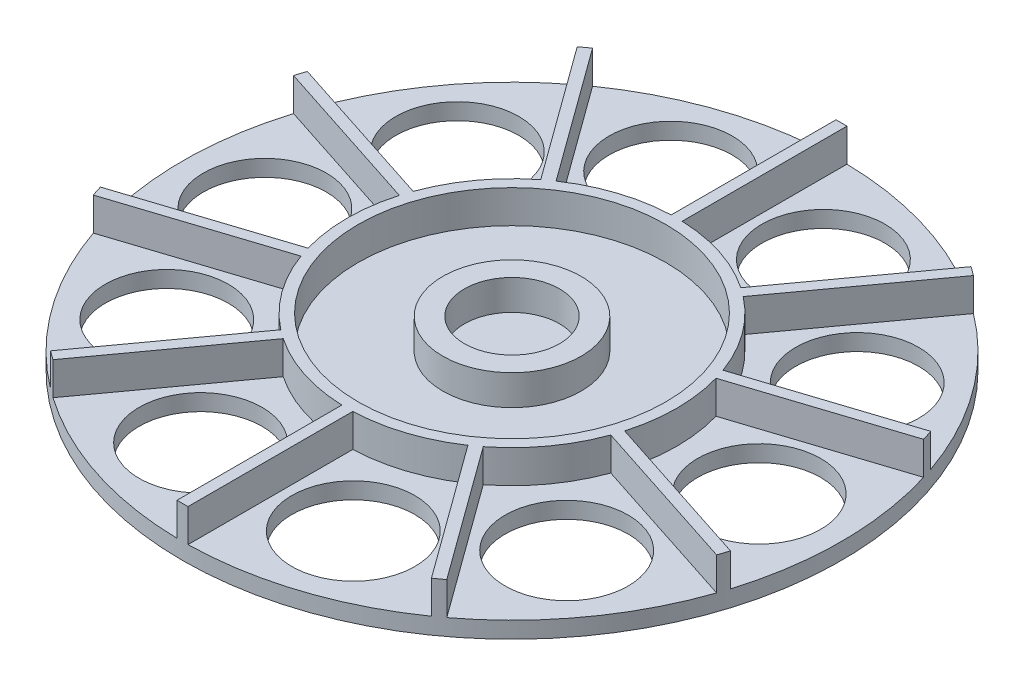
from build123d import *
from build123d.topology import SkipClean

# Parameters (mm, degrees)
SKETCH1_R           = 76.2
SKETCH1_R_2         = 14.224
BOSS_EXTRUDE1_DEPTH = 3.81
SKETCH3_R           = 38.1
SKETCH3_R_2         = 35.56
BOSS_EXTRUDE3_DEPTH = 7.62
BOSS_EXTRUDE4_DEPTH = 7.62
SKETCH4_R           = 16
SKETCH4_R_2         = 11
BOSS_EXTRUDE5_DEPTH = 7


with BuildPart() as part:
    # Sketch1 → Boss-Extrude1 (new body)
    with BuildSketch(Plane(origin=(0, 0, 0), x_dir=(1, 0, 0), z_dir=(0, 1, 0))):
        with Locations(Location((0, 0, 0), (0, 0, 90))):
            Circle(SKETCH1_R)
        with Locations(Location((-57.15, 0, 0), (0, 0, 90))):
            Circle(SKETCH1_R_2, mode=Mode.SUBTRACT)
        with Locations(Location((-46.235321229, 33.591927169, 0), (0, 0, 90))):
            Circle(SKETCH1_R_2, mode=Mode.SUBTRACT)
        with Locations(Location((-17.660321229, 54.352879906, 0), (0, 0, 90))):
            Circle(SKETCH1_R_2, mode=Mode.SUBTRACT)
        with Locations(Location((17.660321229, 54.352879906, 0), (0, 0, 90))):
            Circle(SKETCH1_R_2, mode=Mode.SUBTRACT)
        with Locations(Location((46.235321229, 33.591927169, 0), (0, 0, 90))):
            Circle(SKETCH1_R_2, mode=Mode.SUBTRACT)
        with Locations(Location((57.15, 0, 0), (0, 0, 90))):
            Circle(SKETCH1_R_2, mode=Mode.SUBTRACT)
        with Locations(Location((46.235321229, -33.591927169, 0), (0, 0, 90))):
            Circle(SKETCH1_R_2, mode=Mode.SUBTRACT)
        with Locations(Location((17.660321229, -54.352879906, 0), (0, 0, 90))):
            Circle(SKETCH1_R_2, mode=Mode.SUBTRACT)
        with Locations(Location((-17.660321229, -54.352879906, 0), (0, 0, 90))):
            Circle(SKETCH1_R_2, mode=Mode.SUBTRACT)
        with Locations(Location((-46.235321229, -33.591927169, 0), (0, 0, 90))):
            Circle(SKETCH1_R_2, mode=Mode.SUBTRACT)
    extrude(amount=BOSS_EXTRUDE1_DEPTH)

    # Sketch3 → Boss-Extrude3 (add)
    with BuildSketch(Plane(origin=(0, 3.81, 0), x_dir=(1, 0, 0), z_dir=(0, 1, 0))):
        with Locations(Location((0, 0, 0), (0, 0, 90))):
            Circle(SKETCH3_R)
        with Locations(Location((0, 0, 0), (0, 0, 90))):
            Circle(SKETCH3_R_2, mode=Mode.SUBTRACT)
    extrude(amount=BOSS_EXTRUDE3_DEPTH)

    # Sketch2 → Boss-Extrude4 (add)
    with SkipClean():  # the faces are left unmerged after this step: merging them gives an invalid solid
        with BuildSketch(Plane(origin=(0, 3.81, 0), x_dir=(1, 0, 0), z_dir=(0, 1, 0))):
            with BuildLine():
                Line((-72.852892077, -22.335982539), (-36.607568562, -10.559163032))
                ThreePointArc((-36.607568562, -10.559163032), (-36.235253271, -11.773547486), (-35.822665397, -12.974846584))
                Line((-35.822665397, -12.974846584), (-72.067988912, -24.75166609))
                ThreePointArc((-72.067988912, -24.75166609), (-72.470506542, -23.547094971), (-72.852892077, -22.335982539))
            make_face()
            with BuildLine():
                Line((-72.067988912, 24.75166609), (-35.822665397, 12.974846584))
                ThreePointArc((-35.822665397, 12.974846584), (-36.235253271, 11.773547486), (-36.607568562, 10.559163032))
                Line((-36.607568562, 10.559163032), (-72.852892077, 22.335982539))
                ThreePointArc((-72.852892077, 22.335982539), (-72.470506542, 23.547094971), (-72.067988912, 24.75166609))
            make_face()
            with BuildLine():
                Line((-43.755563483, 62.385019551), (-21.354721617, 31.552905804))
                ThreePointArc((-21.354721617, 31.552905804), (-22.394618112, 30.823547486), (-23.409624783, 30.059931263))
                Line((-23.409624783, 30.059931263), (-45.810466648, 60.89204501))
                ThreePointArc((-45.810466648, 60.89204501), (-44.789236225, 61.647094971), (-43.755563483, 62.385019551))
            make_face()
            with BuildLine():
                Line((1.27, 76.189415932), (1.27, 38.07882745))
                ThreePointArc((1.27, 38.07882745), (0, 38.1), (-1.27, 38.07882745))
                Line((-1.27, 38.07882745), (-1.27, 76.189415932))
                ThreePointArc((-1.27, 76.189415932), (0, 76.2), (1.27, 76.189415932))
            make_face()
            with BuildLine():
                Line((45.810466648, 60.89204501), (23.409624783, 30.059931263))
                ThreePointArc((23.409624783, 30.059931263), (22.394618112, 30.823547486), (21.354721617, 31.552905804))
                Line((21.354721617, 31.552905804), (43.755563483, 62.385019551))
                ThreePointArc((43.755563483, 62.385019551), (44.789236225, 61.647094971), (45.810466648, 60.89204501))
            make_face()
            with BuildLine():
                Line((72.852892077, 22.335982539), (36.607568562, 10.559163032))
                ThreePointArc((36.607568562, 10.559163032), (36.235253271, 11.773547486), (35.822665397, 12.974846584))
                Line((35.822665397, 12.974846584), (72.067988912, 24.75166609))
                ThreePointArc((72.067988912, 24.75166609), (72.470506542, 23.547094971), (72.852892077, 22.335982539))
            make_face()
            with BuildLine():
                Line((72.067988912, -24.75166609), (35.822665397, -12.974846584))
                ThreePointArc((35.822665397, -12.974846584), (36.235253271, -11.773547486), (36.607568562, -10.559163032))
                Line((36.607568562, -10.559163032), (72.852892077, -22.335982539))
                ThreePointArc((72.852892077, -22.335982539), (72.470506542, -23.547094971), (72.067988912, -24.75166609))
            make_face()
            with BuildLine():
                Line((43.755563483, -62.385019551), (21.354721617, -31.552905804))
                ThreePointArc((21.354721617, -31.552905804), (22.394618112, -30.823547486), (23.409624783, -30.059931263))
                Line((23.409624783, -30.059931263), (45.810466648, -60.89204501))
                ThreePointArc((45.810466648, -60.89204501), (44.789236225, -61.647094971), (43.755563483, -62.385019551))
            make_face()
            with BuildLine():
                Line((-1.27, -76.189415932), (-1.27, -38.07882745))
                ThreePointArc((-1.27, -38.07882745), (0, -38.1), (1.27, -38.07882745))
                Line((1.27, -38.07882745), (1.27, -76.189415932))
                ThreePointArc((1.27, -76.189415932), (0, -76.2), (-1.27, -76.189415932))
            make_face()
            with BuildLine():
                Line((-45.810466648, -60.89204501), (-23.409624783, -30.059931263))
                ThreePointArc((-23.409624783, -30.059931263), (-22.394618112, -30.823547486), (-21.354721617, -31.552905804))
                Line((-21.354721617, -31.552905804), (-43.755563483, -62.385019551))
                ThreePointArc((-43.755563483, -62.385019551), (-44.789236225, -61.647094971), (-45.810466648, -60.89204501))
            make_face()
        extrude(amount=BOSS_EXTRUDE4_DEPTH)

    # Sketch4 → Boss-Extrude5 (add)
    with SkipClean():  # the faces are left unmerged after this step: merging them gives an invalid solid
        with BuildSketch(Plane(origin=(0, 3.81, 0), x_dir=(1, 0, 0), z_dir=(0, 1, 0))):
            with Locations(Location((0, 0, 0), (0, 0, 270))):
                Circle(SKETCH4_R)
            with Locations(Location((0, 0, 0), (0, 0, 270))):
                Circle(SKETCH4_R_2, mode=Mode.SUBTRACT)
        extrude(amount=BOSS_EXTRUDE5_DEPTH)


solid = part.part
